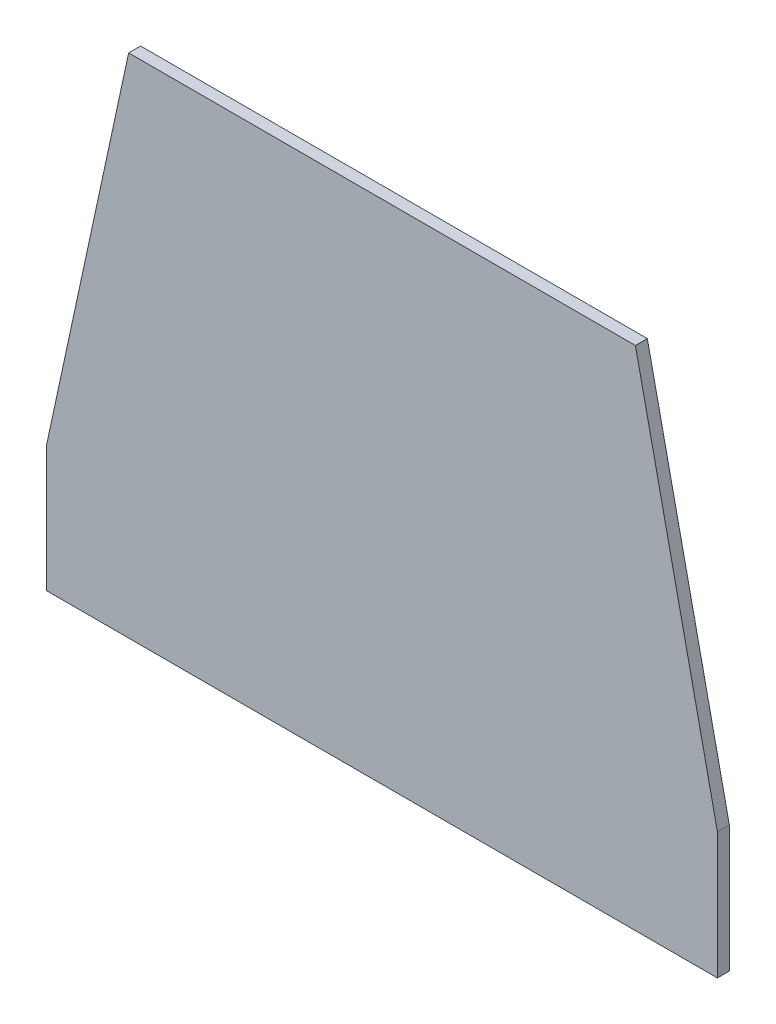
from build123d import *

# Parameters (mm, degrees)
EXTRUDE_1042_DEPTH = 16


with BuildPart() as part:
    # 草图2 → Extrude 1042 (new body)
    with BuildSketch(Plane.XY):
        Polygon((110, 680), (0, 170), (0, 0), (900, 0), (900, 170), (790, 680), align=None)
    extrude(amount=EXTRUDE_1042_DEPTH)


solid = part.part
